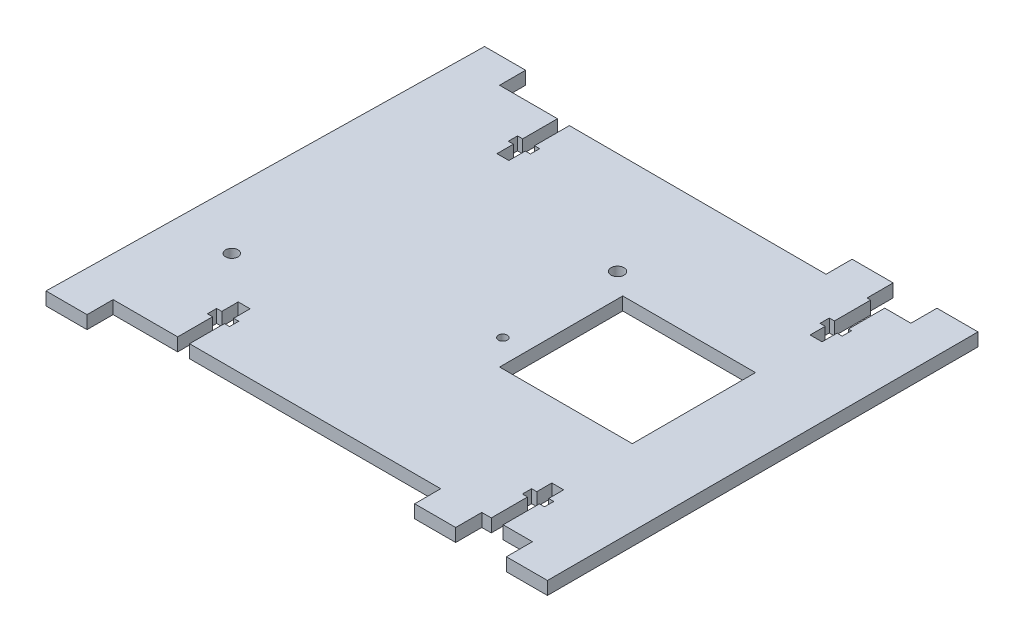
from build123d import *

# Parameters (mm, degrees)
SKETCH1_R      = 1.50705101
SKETCH1_R_2    = 1.0795
SKETCH1_R_3    = 1.58353158
SKETCH1_W      = 32.345315457
SKETCH1_H      = 30
EXTRUDE1_DEPTH = 3.175


with BuildPart() as part:
    # Sketch1 → Extrude1 (new body)
    with BuildSketch(Plane(origin=(0, 0, 0), x_dir=(1, 0, 0), z_dir=(0, 1, 0))):
        Polygon((-67.158636898, 70.484310302), (-67.158636898, 74.492800404), (-68.408636898, 74.492800404), (-68.408636898, 76.742800404), (-67.158636898, 76.742800404), (-67.158636898, 85.234310302), (-81.279057464, 85.234310302), (-81.279057464, 91.584310302), (-91.279057464, 91.584310302), (-93.1320954, -13.415689698), (-83.1320954, -13.415689698), (-83.1320954, -7.065689698), (-67.402600688, -7.065689698), (-67.402600688, 1.425820201), (-68.652600688, 1.425820201), (-68.652600688, 3.675820201), (-67.402600688, 3.675820201), (-67.402600688, 7.684310302), (-64.502600688, 7.684310302), (-64.502600688, 3.675820201), (-63.252600688, 3.675820201), (-63.252600688, 1.425820201), (-64.502600688, 1.425820201), (-64.502600688, -7.065689698), (-3.311856943, -7.065689698), (-3.31328789, -13.417119454), (6.68671211, -13.417119454), (6.68671211, -7.065689698), (9.00171211, -7.065689698), (9.00171211, 1.771032224), (7.75171211, 1.771032224), (7.75171211, 4.021032224), (9.00171211, 4.021032224), (9.00171211, 7.684310302), (11.90171211, 7.684310302), (11.90171211, 4.021032224), (13.15171211, 4.021032224), (13.15171211, 1.771032224), (11.90171211, 1.771032224), (11.90171211, -7.065689698), (19.042987782, -7.065689698), (19.042987782, -13.417119454), (29.042987782, -13.417119454), (29.042987782, 91.482596586), (19.042987782, 91.482596586), (19.042987782, 85.132545763), (12.668135492, 85.132592736), (12.668135492, 76.295870815), (13.395675901, 76.295870815), (13.395675901, 74.045870815), (12.145675901, 74.045870815), (12.145675901, 70.382596586), (9.245675901, 70.382596586), (9.245675901, 74.045874665), (7.995675901, 74.045874665), (7.995675901, 76.295874665), (9.245675901, 76.295874665), (9.245675901, 85.132596586), (8.371396704, 85.132596586), (8.371396704, 91.482596586), (-1.628603296, 91.482596586), (-1.628603296, 85.132596586), (-64.258636898, 85.234310302), (-64.258636898, 76.742800404), (-63.008636898, 76.742800404), (-63.008636898, 74.492800404), (-64.258636898, 74.492800404), (-64.258636898, 70.484310302), align=None)
        with Locations(Location((-78.42302428, 17.147481819, 0), (0, 0, 270))):
            Circle(SKETCH1_R, mode=Mode.SUBTRACT)
        with Locations(Location((-27.62307508, 32.387481819, 0), (0, 0, 270))):
            Circle(SKETCH1_R_2, mode=Mode.SUBTRACT)
        with Locations(Location((-27.62307508, 60.327481819, 0), (0, 0, 270))):
            Circle(SKETCH1_R_3, mode=Mode.SUBTRACT)
        with Locations((-5.646064502, 40.784310302)):
            Rectangle(SKETCH1_W, SKETCH1_H, mode=Mode.SUBTRACT)
    extrude(amount=EXTRUDE1_DEPTH)


solid = part.part
